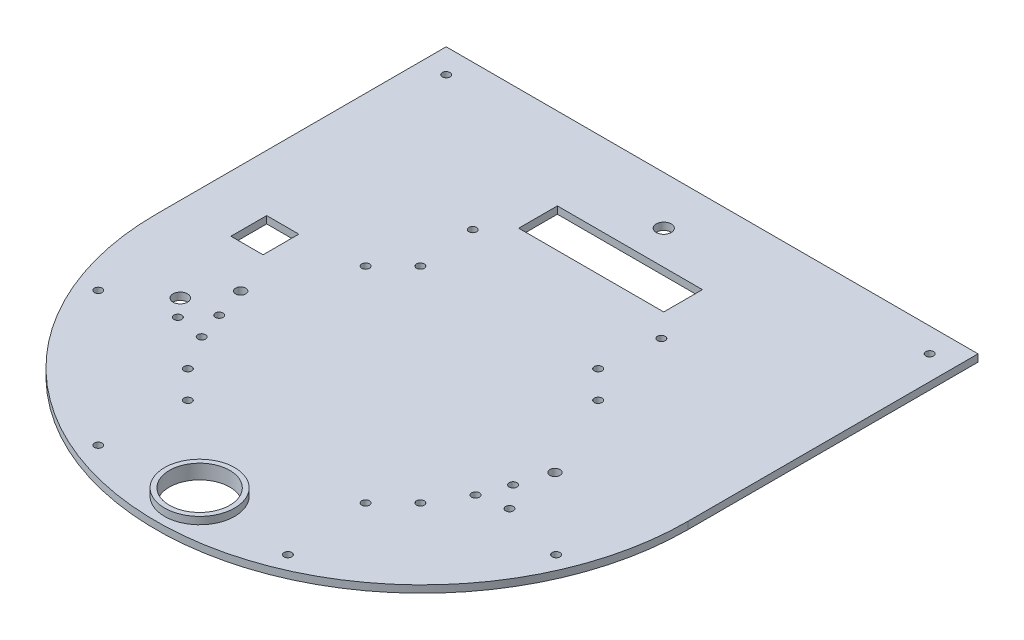
from build123d import *

# Parameters (mm, degrees)
EXTRUDE_START            = -1
EXTRUDE_1_DEPTH          = 3
SKETCH_2_R               = 12.5
CUT_EXTRUDE_1_DEPTH      = 10
SKETCH_3_W               = 220
SKETCH_3_H               = 40
EXTRUDE_2_DEPTH          = 3
CUT_EXTRUDE_2_DEPTH      = 163.815846895
CUT_EXTRUDE_2_DEPTH_BACK = 163.815846895
SKETCH_4_W               = 60
SKETCH_4_H               = 16
SKETCH_5_R               = 1.6
SKETCH_5_R_2             = 2.1
SKETCH_5_R_3             = 3
SKETCH_5_R_4             = 3.1
SKETCH_5_W               = 13.3
SKETCH_5_H               = 14.8
CUT_EXTRUDE_3_DEPTH      = 10
SKETCH_7_R               = 1.6
CUT_EXTRUDE_6_DEPTH      = 162.347451173
SKETCH_8_R               = 1.6
CUT_EXTRUDE_7_DEPTH      = 162.347451173
SHEET_EXTRUDE_1_1_DEPTH  = 3
THICKEN_1_T2             = 2


with BuildPart() as part:
    # 草图1 → 凸台-拉伸1 (new body)
    with BuildSketch(Plane(origin=(0, 0, 0), x_dir=(1, 0, 0), z_dir=(0, 1, 0)).offset(EXTRUDE_START)):
        with BuildLine():
            Line((-110, 0), (-110, 80))
            Line((-110, 80), (110, 80))
            Line((110, 80), (110, 0))
            ThreePointArc((110, 0), (0, -110), (-110, 0))
        make_face()
    extrude(amount=EXTRUDE_1_DEPTH)

    # 草图2 → 切除-拉伸1 (cut)
    with BuildSketch(Plane(origin=(0, 2, 0), x_dir=(1, 0, 0), z_dir=(0, 1, 0))):
        with Locations(Location((0, -92, 0), (0, 0, 270))):
            Circle(SKETCH_2_R)
    extrude(amount=-CUT_EXTRUDE_1_DEPTH, mode=Mode.SUBTRACT)

    # 草图3 → 凸台-拉伸2 (add)
    with BuildSketch(Plane(origin=(0, 2, 0), x_dir=(1, 0, 0), z_dir=(0, 1, 0))):
        with Locations((0, 100)):
            Rectangle(SKETCH_3_W, SKETCH_3_H)
    extrude(amount=-EXTRUDE_2_DEPTH)

    # 草图4 → 切除-拉伸2 (cut, two sides: drawn at the far end of the back side and taken through both)
    with BuildSketch(Plane(origin=(0, 2, 0), x_dir=(1, 0, 0), z_dir=(0, 1, 0)).offset(-CUT_EXTRUDE_2_DEPTH_BACK)):
        with Locations((0, 78)):
            Rectangle(SKETCH_4_W, SKETCH_4_H)
    extrude(amount=CUT_EXTRUDE_2_DEPTH + CUT_EXTRUDE_2_DEPTH_BACK, mode=Mode.SUBTRACT)

    # 草图5 → 切除-拉伸3 (cut)
    with BuildSketch(Plane(origin=(0, 2, 0), x_dir=(1, 0, 0), z_dir=(0, 1, 0))):
        with Locations(Location((94.697652082, -39.225051817, 0), (0, 0, 270))):
            Circle(SKETCH_5_R)
        with Locations(Location((39.225051817, -94.697652082, 0), (0, 0, 270))):
            Circle(SKETCH_5_R)
        with Locations(Location((-39.225051817, -94.697652082, 0), (0, 0, 270))):
            Circle(SKETCH_5_R)
        with Locations(Location((-94.697652082, -39.225051817, 0), (0, 0, 270))):
            Circle(SKETCH_5_R)
        with Locations(Location((-65, -10, 0), (0, 0, 270))):
            Circle(SKETCH_5_R_2)
        with Locations(Location((65, -10, 0), (0, 0, 270))):
            Circle(SKETCH_5_R_2)
        with Locations(Location((-75, -25, 0), (0, 0, 270))):
            Circle(SKETCH_5_R_3)
        with Locations(Location((-100, 110, 0), (0, 0, 270))):
            Circle(SKETCH_5_R)
        with Locations(Location((100, 110, 0), (0, 0, 270))):
            Circle(SKETCH_5_R)
        with Locations(Location((-39, 60, 0), (0, 0, 270))):
            Circle(SKETCH_5_R)
        with Locations(Location((39, 60, 0), (0, 0, 270))):
            Circle(SKETCH_5_R)
        with Locations(Location((0, 100, 0), (0, 0, 270))):
            Circle(SKETCH_5_R_4)
        with Locations((-80, 15)):
            Rectangle(SKETCH_5_W, SKETCH_5_H)
    extrude(amount=-CUT_EXTRUDE_3_DEPTH, mode=Mode.SUBTRACT)

    # 草图7 → 切除-拉伸6 (cut, through all)
    with BuildSketch(Plane(origin=(0, 2, -2), x_dir=(1, 0, 0), z_dir=(0, -1, 0))):
        with Locations(Location((-48.083261121, -22.769552622, 0), (0, 0, 270))):
            Circle(SKETCH_7_R)
        with Locations(Location((-36.769552622, -34.083261121, 0), (0, 0, 270))):
            Circle(SKETCH_7_R)
        with Locations(Location((48.083261121, -22.769552622, 0), (0, 0, 90))):
            Circle(SKETCH_7_R)
        with Locations(Location((36.769552622, -34.083261121, 0), (0, 0, 90))):
            Circle(SKETCH_7_R)
        with Locations(Location((-48.083261121, 50.769552622, 0), (0, 0, 90))):
            Circle(SKETCH_7_R)
        with Locations(Location((-36.769552622, 62.083261121, 0), (0, 0, 90))):
            Circle(SKETCH_7_R)
        with Locations(Location((36.769552622, 62.083261121, 0), (0, 0, 270))):
            Circle(SKETCH_7_R)
        with Locations(Location((48.083261121, 50.769552622, 0), (0, 0, 270))):
            Circle(SKETCH_7_R)
    extrude(amount=CUT_EXTRUDE_6_DEPTH, mode=Mode.SUBTRACT)

    # 草图8 → 切除-拉伸7 (cut, through all)
    with BuildSketch(Plane(origin=(0, 2, -2), x_dir=(1, 0, 0), z_dir=(0, -1, 0))):
        with Locations(Location((68.577848346, 34.394141003, 0), (0, 0, 270))):
            Circle(SKETCH_8_R)
        with Locations(Location((60.784462756, 25.106345729, 0), (0, 0, 270))):
            Circle(SKETCH_8_R)
        with Locations(Location((56.637688898, 36.499513268, 0), (0, 0, 270))):
            Circle(SKETCH_8_R)
        with Locations(Location((-60.784462756, 25.106345729, 0), (0, 0, 90))):
            Circle(SKETCH_8_R)
        with Locations(Location((-56.637688898, 36.499513268, 0), (0, 0, 90))):
            Circle(SKETCH_8_R)
        with Locations(Location((-68.577848346, 34.394141003, 0), (0, 0, 90))):
            Circle(SKETCH_8_R)
    extrude(amount=CUT_EXTRUDE_7_DEPTH, mode=Mode.SUBTRACT)

    # Sheet 凸台-拉伸1: a surface, the sketch's curves swept straight by 3 mm
    with BuildLine(Plane(origin=(0, 2, 0), x_dir=(1, 0, 0), z_dir=(0, 1, 0)), mode=Mode.PRIVATE) as sheet_extrude_1_1_path:
        CenterArc((0, -92), 12.5, 0, 360)
    sheet_extrude_1_1 = Shell.extrude(sheet_extrude_1_1_path.wire(), (0 * SHEET_EXTRUDE_1_1_DEPTH, 1 * SHEET_EXTRUDE_1_1_DEPTH, 0 * SHEET_EXTRUDE_1_1_DEPTH))
    add(Solid.thicken(sheet_extrude_1_1, -THICKEN_1_T2))


solid = part.part
